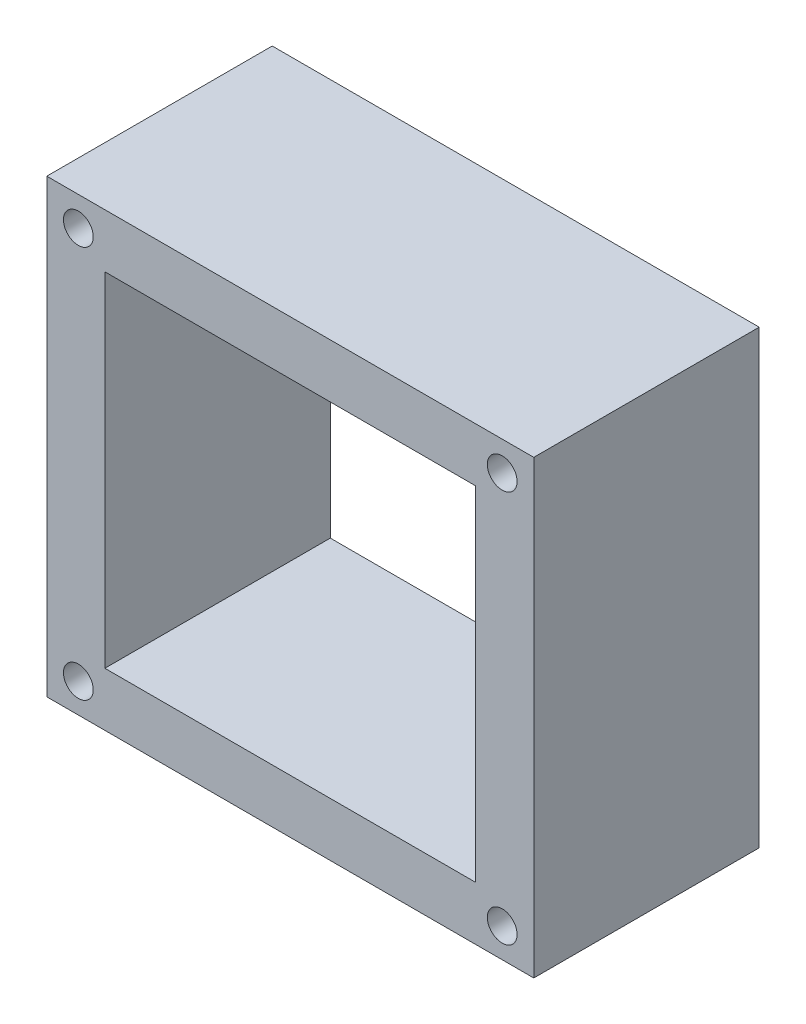
from build123d import *

# Parameters (mm, degrees)
SKETCH1_W           = 108
SKETCH1_H           = 100
SKETCH1_R           = 3.3
SKETCH1_W_2         = 82.24138234
SKETCH1_H_2         = 76.149428092
BOSS_EXTRUDE1_DEPTH = 50


with BuildPart() as part:
    # Sketch1 → Boss-Extrude1 (new body)
    with BuildSketch(Plane.XY):
        Rectangle(SKETCH1_W, SKETCH1_H)
        with Locations((47, 43.5)):
            Circle(SKETCH1_R, mode=Mode.SUBTRACT)
        with Locations((47, -43.5)):
            Circle(SKETCH1_R, mode=Mode.SUBTRACT)
        with Locations((-47, -43.5)):
            Circle(SKETCH1_R, mode=Mode.SUBTRACT)
        with Locations((-47, 43.5)):
            Circle(SKETCH1_R, mode=Mode.SUBTRACT)
        Rectangle(SKETCH1_W_2, SKETCH1_H_2, mode=Mode.SUBTRACT)
    extrude(amount=BOSS_EXTRUDE1_DEPTH)


solid = part.part
